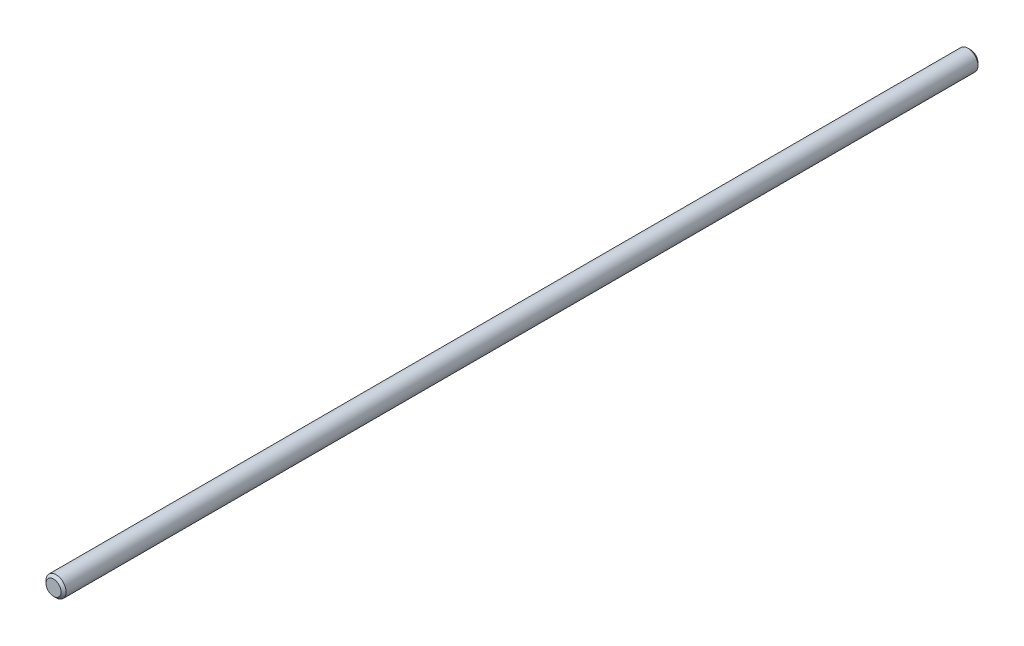
from build123d import *

# Parameters (mm, degrees)
SKETCH1_R           = 4
BOSS_EXTRUDE1_DEPTH = 365
CHAMFER1_SIZE       = 1


with BuildPart() as part:
    # Sketch1 → Boss-Extrude1 (new body)
    with BuildSketch(Plane.XY):
        with Locations(Location((0, 0, 0), (0, 0, 180))):
            Circle(SKETCH1_R)
    extrude(amount=BOSS_EXTRUDE1_DEPTH)

    # Chamfer1
    chamfer1_edges = [part.edges().sort_by_distance(p)[0] for p in [
        (4, 0, 0),
        (4, 0, 365),
    ]]
    chamfer(chamfer1_edges, length=CHAMFER1_SIZE)


solid = part.part
